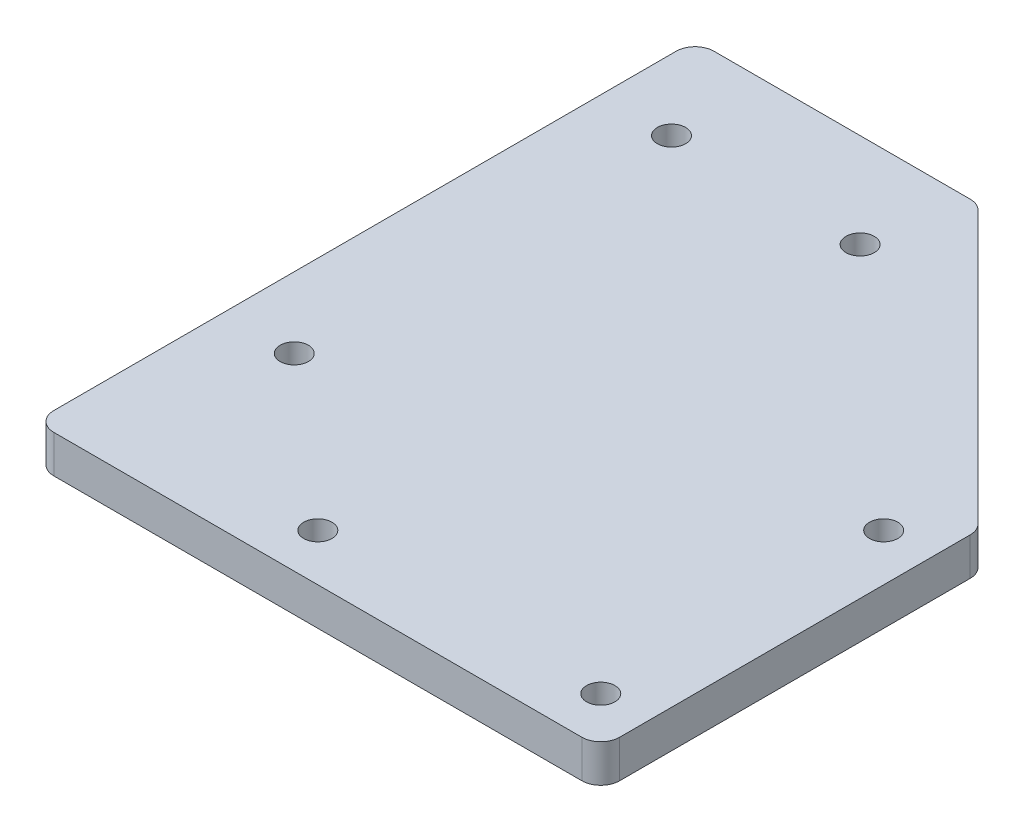
from build123d import *

# Parameters (mm, degrees)
EXTRUDE_1_DEPTH     = 4
SKETCH_2_R          = 1.5
CUT_EXTRUDE_1_DEPTH = 4
FILLET_1_R          = 2
SKETCH_3_R          = 1.5
CUT_EXTRUDE_2_DEPTH = 4
SKETCH_4_R          = 1.5
CUT_EXTRUDE_3_DEPTH = 4
SKETCH_5_R          = 1.5
CUT_EXTRUDE_4_DEPTH = 4
SKETCH_6_R          = 1.5
CUT_EXTRUDE_5_DEPTH = 4


with BuildPart() as part:
    # 草图1 → 凸台-拉伸1 (new body)
    with BuildSketch(Plane(origin=(0, 0, 0), x_dir=(1, 0, 0), z_dir=(0, 1, 0))):
        Polygon((0, 0), (60, 0), (60, 40), (30, 70), (0, 70), align=None)
    extrude(amount=EXTRUDE_1_DEPTH)

    # 草图2 → 切除-拉伸1 (cut)
    with BuildSketch(Plane(origin=(0, 4, 0), x_dir=(1, 0, 0), z_dir=(0, 1, 0))):
        with Locations(Location((7.5, 20, 0), (0, 0, 270))):
            Circle(SKETCH_2_R)
        with Locations(Location((7.5, 60, 0), (0, 0, 270))):
            Circle(SKETCH_2_R)
    extrude(amount=-CUT_EXTRUDE_1_DEPTH, mode=Mode.SUBTRACT)

    # 圆角1
    fillet_1_edges = [part.edges().sort_by_distance(p)[0] for p in [
        (0, 2, -70),
        (30, 2, -70),
        (60, 2, -40),
        (60, 2, 0),
        (0, 2, 0),
    ]]
    fillet(fillet_1_edges, radius=FILLET_1_R)

    # 草图3 → 切除-拉伸2 (cut)
    with BuildSketch(Plane(origin=(0, 4, 0), x_dir=(1, 0, 0), z_dir=(0, 1, 0))):
        with Locations(Location((55, 5, 0), (0, 0, 270))):
            Circle(SKETCH_3_R)
    extrude(amount=-CUT_EXTRUDE_2_DEPTH, mode=Mode.SUBTRACT)

    # 草图4 → 切除-拉伸3 (cut)
    with BuildSketch(Plane(origin=(0, 4, 0), x_dir=(1, 0, 0), z_dir=(0, 1, 0))):
        with Locations(Location((27.5, 60, 0), (0, 0, 270))):
            Circle(SKETCH_4_R)
    extrude(amount=-CUT_EXTRUDE_3_DEPTH, mode=Mode.SUBTRACT)

    # 草图5 → 切除-拉伸4 (cut)
    with BuildSketch(Plane(origin=(0, 4, 0), x_dir=(1, 0, 0), z_dir=(0, 1, 0))):
        with Locations(Location((25, 5, 0), (0, 0, 270))):
            Circle(SKETCH_5_R)
    extrude(amount=-CUT_EXTRUDE_4_DEPTH, mode=Mode.SUBTRACT)

    # 草图6 → 切除-拉伸5 (cut)
    with BuildSketch(Plane(origin=(0, 4, 0), x_dir=(1, 0, 0), z_dir=(0, 1, 0))):
        with Locations(Location((55, 35, 0), (0, 0, 270))):
            Circle(SKETCH_6_R)
    extrude(amount=-CUT_EXTRUDE_5_DEPTH, mode=Mode.SUBTRACT)


solid = part.part
